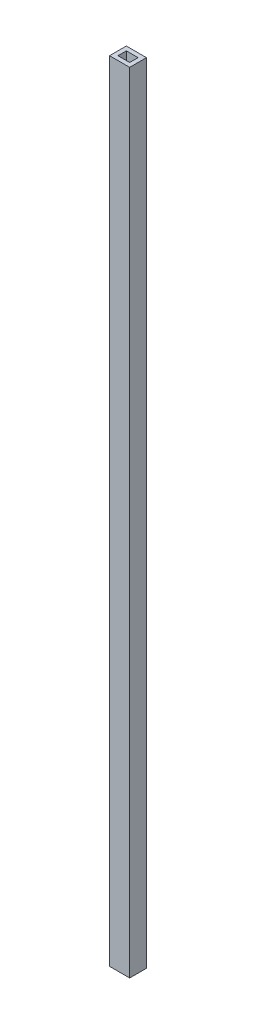
from build123d import *

# Parameters (mm, degrees)
ESQUISSE1_W        = 15.24
ESQUISSE1_H        = 12.7
ESQUISSE1_W_2      = 8.89
ESQUISSE1_H_2      = 6.35
BOSS_EXTRU_1_DEPTH = 596.9


with BuildPart() as part:
    # Esquisse1 → Boss.-Extru.1 (new body)
    with BuildSketch(Plane(origin=(0, 0, 0), x_dir=(1, 0, 0), z_dir=(0, 1, 0))):
        Rectangle(ESQUISSE1_W, ESQUISSE1_H)
        Rectangle(ESQUISSE1_W_2, ESQUISSE1_H_2, mode=Mode.SUBTRACT)
    extrude(amount=BOSS_EXTRU_1_DEPTH)


solid = part.part
